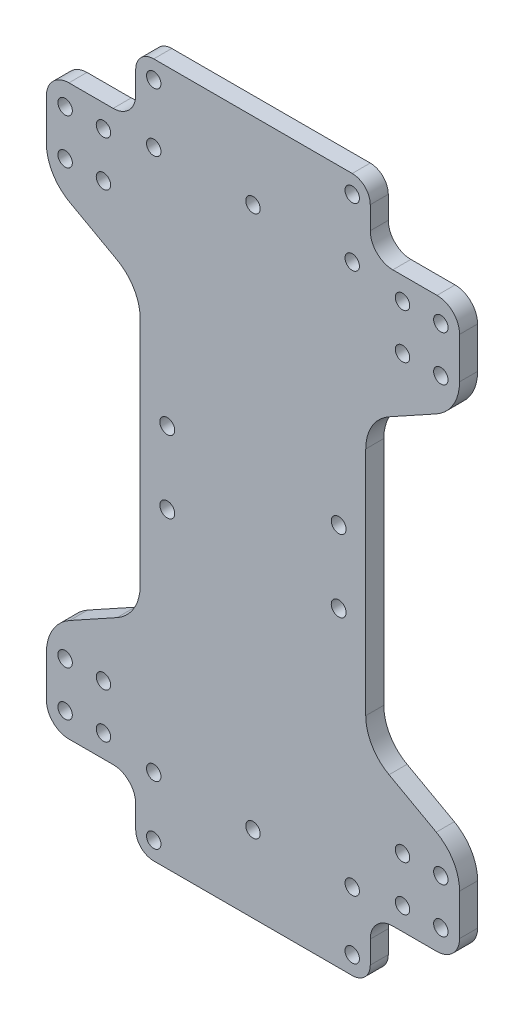
from build123d import *

# Parameters (mm, degrees)
SKETCH1_R           = 1.6
SKETCH1_R_2         = 1.65
BOSS_EXTRUDE1_DEPTH = 4
FILLET2_R           = 10
FILLET3_R           = 5


with BuildPart() as part:
    # Sketch1 → Boss-Extrude1 (new body)
    with BuildSketch(Plane.XY):
        with BuildLine():
            Line((1.40773023, -0.063608297), (16.206941284, -0.063608297))
            ThreePointArc((16.206941284, -0.063608297), (19.74247519, -1.528074391), (21.206941284, -5.063608297))
            Line((21.206941284, -5.063608297), (21.206941284, -10.063608297))
            ThreePointArc((21.206941284, -10.063608297), (22.37851416, -12.892035422), (25.206941284, -14.063608297))
            Line((25.206941284, -14.063608297), (69.208519176, -14.063608297))
            ThreePointArc((69.208519176, -14.063608297), (72.036946301, -12.892035422), (73.208519176, -10.063608297))
            Line((73.208519176, -10.063608297), (73.208519176, -5.063608297))
            ThreePointArc((73.208519176, -5.063608297), (74.67298527, -1.528074391), (78.208519176, -0.063608297))
            Line((78.208519176, -0.063608297), (93.00773023, -0.063608297))
            Line((93.00773023, -0.063608297), (93.00773023, 19.936391703))
            Line((93.00773023, 19.936391703), (72.20773023, 31.430017028))
            Line((72.20773023, 31.430017028), (72.20773023, 94.442766377))
            Line((72.20773023, 94.442766377), (93.00773023, 105.936391703))
            Line((93.00773023, 105.936391703), (93.00773023, 125.936391703))
            Line((93.00773023, 125.936391703), (78.208519176, 125.936391703))
            ThreePointArc((78.208519176, 125.936391703), (74.67298527, 127.400857797), (73.208519176, 130.936391703))
            Line((73.208519176, 130.936391703), (73.208519176, 135.936391703))
            ThreePointArc((73.208519176, 135.936391703), (72.036946301, 138.764818827), (69.208519176, 139.936391703))
            Line((69.208519176, 139.936391703), (25.206941284, 139.936391703))
            ThreePointArc((25.206941284, 139.936391703), (22.37851416, 138.764818827), (21.206941284, 135.936391703))
            Line((21.206941284, 135.936391703), (21.206941284, 130.936391703))
            ThreePointArc((21.206941284, 130.936391703), (19.74247519, 127.400857797), (16.206941284, 125.936391703))
            Line((16.206941284, 125.936391703), (1.40773023, 125.936391703))
            Line((1.40773023, 125.936391703), (1.40773023, 105.936391703))
            Line((1.40773023, 105.936391703), (22.20773023, 94.442766377))
            Line((22.20773023, 94.442766377), (22.20773023, 31.430017028))
            Line((22.20773023, 31.430017028), (1.40773023, 19.936391703))
            Line((1.40773023, 19.936391703), (1.40773023, -0.063608297))
        make_face()
        with Locations((5.55773023, 4.936391703)):
            Circle(SKETCH1_R, mode=Mode.SUBTRACT)
        with Locations((14.05773023, 4.936391703)):
            Circle(SKETCH1_R, mode=Mode.SUBTRACT)
        with Locations((14.05773023, 14.936391703)):
            Circle(SKETCH1_R, mode=Mode.SUBTRACT)
        with Locations((5.55773023, 14.936391703)):
            Circle(SKETCH1_R, mode=Mode.SUBTRACT)
        with Locations(Location((69.208519176, -10.063608297, 0), (0, 0, 180))):
            Circle(SKETCH1_R, mode=Mode.SUBTRACT)
        with Locations(Location((69.208519176, 2.936391703, 0), (0, 0, 180))):
            Circle(SKETCH1_R, mode=Mode.SUBTRACT)
        with Locations((47.206941284, 2.936391703)):
            Circle(SKETCH1_R, mode=Mode.SUBTRACT)
        with Locations(Location((66.20773023, 54.936391703, 0), (0, 0, 180))):
            Circle(SKETCH1_R_2, mode=Mode.SUBTRACT)
        with Locations(Location((88.85773023, 14.936391703, 0), (0, 0, 180))):
            Circle(SKETCH1_R, mode=Mode.SUBTRACT)
        with Locations(Location((80.35773023, 14.936391703, 0), (0, 0, 180))):
            Circle(SKETCH1_R, mode=Mode.SUBTRACT)
        with Locations(Location((80.35773023, 4.936391703, 0), (0, 0, 180))):
            Circle(SKETCH1_R, mode=Mode.SUBTRACT)
        with Locations(Location((88.85773023, 4.936391703, 0), (0, 0, 180))):
            Circle(SKETCH1_R, mode=Mode.SUBTRACT)
        with Locations((28.20773023, 54.936391703)):
            Circle(SKETCH1_R_2, mode=Mode.SUBTRACT)
        with Locations(Location((25.206941284, 135.936391703, 0), (0, 0, 180))):
            Circle(SKETCH1_R, mode=Mode.SUBTRACT)
        with Locations((25.206941284, 2.936391703)):
            Circle(SKETCH1_R, mode=Mode.SUBTRACT)
        with Locations(Location((25.206941284, 122.936391703, 0), (0, 0, 180))):
            Circle(SKETCH1_R, mode=Mode.SUBTRACT)
        with Locations(Location((28.20773023, 70.936391703, 0), (0, 0, 180))):
            Circle(SKETCH1_R_2, mode=Mode.SUBTRACT)
        with Locations((25.206941284, -10.063608297)):
            Circle(SKETCH1_R, mode=Mode.SUBTRACT)
        with Locations((88.85773023, 120.936391703)):
            Circle(SKETCH1_R, mode=Mode.SUBTRACT)
        with Locations((80.35773023, 120.936391703)):
            Circle(SKETCH1_R, mode=Mode.SUBTRACT)
        with Locations((80.35773023, 110.936391703)):
            Circle(SKETCH1_R, mode=Mode.SUBTRACT)
        with Locations((88.85773023, 110.936391703)):
            Circle(SKETCH1_R, mode=Mode.SUBTRACT)
        with Locations((66.20773023, 70.936391703)):
            Circle(SKETCH1_R_2, mode=Mode.SUBTRACT)
        with Locations(Location((47.206941284, 122.936391703, 0), (0, 0, 180))):
            Circle(SKETCH1_R, mode=Mode.SUBTRACT)
        with Locations((69.208519176, 122.936391703)):
            Circle(SKETCH1_R, mode=Mode.SUBTRACT)
        with Locations((69.208519176, 135.936391703)):
            Circle(SKETCH1_R, mode=Mode.SUBTRACT)
        with Locations(Location((5.55773023, 110.936391703, 0), (0, 0, 180))):
            Circle(SKETCH1_R, mode=Mode.SUBTRACT)
        with Locations(Location((14.05773023, 110.936391703, 0), (0, 0, 180))):
            Circle(SKETCH1_R, mode=Mode.SUBTRACT)
        with Locations(Location((14.05773023, 120.936391703, 0), (0, 0, 180))):
            Circle(SKETCH1_R, mode=Mode.SUBTRACT)
        with Locations(Location((5.55773023, 120.936391703, 0), (0, 0, 180))):
            Circle(SKETCH1_R, mode=Mode.SUBTRACT)
    extrude(amount=BOSS_EXTRUDE1_DEPTH)

    # Fillet2
    fillet2_edges = [part.edges().sort_by_distance(p)[0] for p in [
        (1.40773023, 19.936391703, 2),
        (22.20773023, 31.430017028, 2),
        (22.20773023, 94.442766377, 2),
        (1.40773023, 105.936391703, 2),
        (93.00773023, 105.936391703, 2),
        (72.20773023, 94.442766377, 2),
        (72.20773023, 31.430017028, 2),
        (93.00773023, 19.936391703, 2),
    ]]
    fillet(fillet2_edges, radius=FILLET2_R)

    # Fillet3
    fillet3_edges = [part.edges().sort_by_distance(p)[0] for p in [
        (1.40773023, 125.936391703, 2),
        (93.00773023, 125.936391703, 2),
        (93.00773023, -0.063608297, 2),
        (1.40773023, -0.063608297, 2),
    ]]
    fillet(fillet3_edges, radius=FILLET3_R)


solid = part.part
